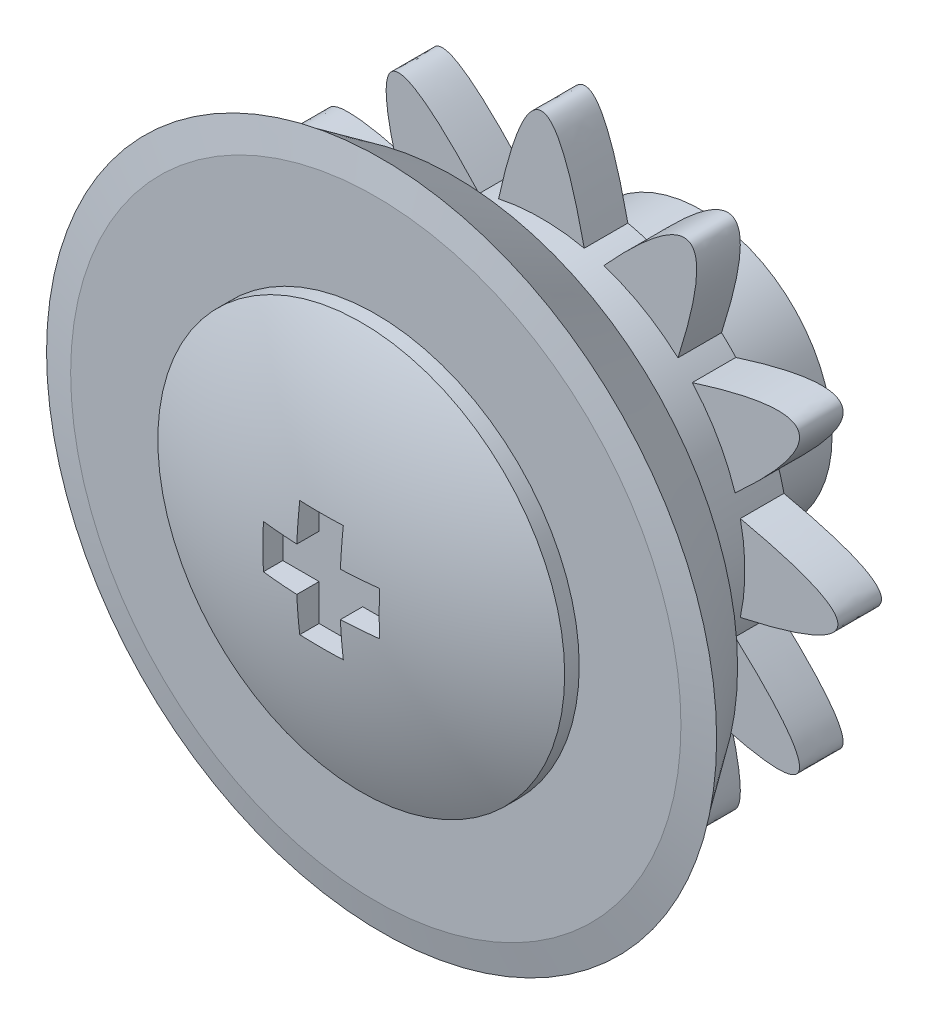
from build123d import *
from build123d.topology import SkipClean

# Parameters (mm, degrees)
SKETCH1_R             = 7
GEARPLATE_DEPTH       = 1.5
BOSS_EXTRUDE3_DEPTH   = 1.5
CIRPATTERN2_COUNT     = 12
SKETCH3_R             = 4.5
BACKPLATE_DEPTH       = 4
SKETCH4_R             = 7
PLATE_DEPTH           = 3
SKETCH6_R             = 11.5
ANGLEPLATE_DEPTH      = 2.5
ANGLEPLATE_DRAFT      = -35
SKETCH8_R             = 10.5
SMALLANGLEPLATE_DEPTH = 0.2
SMALLANGLEPLATE_DRAFT = 79
SKETCH9_R             = 7
DOMEEXTRUDE_DEPTH     = 0.5
DOME1_FACE_RADIUS     = 7
DOME1_HEIGHT          = 1.5
CUT_EXTRUDE1_DEPTH    = 3.8


with BuildPart() as part:
    # Sketch1 → GearPlate (new body)
    with BuildSketch(Plane.XY):
        Circle(SKETCH1_R)
    extrude(amount=GEARPLATE_DEPTH)

    # Sketch2 → Boss-Extrude3 (add)
    with BuildSketch(Plane.XY.offset(1.5)):
        with BuildLine():
            Line((-1.47374446, 6.843104359), (1.47374446, 6.843104359))
            add(Edge.make_bspline(
                [(-1.47374446, 6.843104359), (0, 13.556322037), (1.47374446, 6.843104359)],
                knots=[0, 0, 0, 1, 1, 1], degree=2))
        make_face()
    boss_extrude3 = extrude(amount=-BOSS_EXTRUDE3_DEPTH)

    # CirPattern2: Boss-Extrude3 ×12 about axis
    cirpattern2_axis = Axis((0, 0, 1.5), (0, 0, -1))
    for i in range(1, CIRPATTERN2_COUNT):
        add(boss_extrude3.rotate(cirpattern2_axis, i * 360 / CIRPATTERN2_COUNT))

    # Sketch3 → BackPlate (add)
    with BuildSketch(Plane(origin=(0, 0, 0), x_dir=(-1, 0, 0), z_dir=(0, 0, -1))):
        with Locations(Location((0, 0, 0), (0, 0, 180))):
            Circle(SKETCH3_R)
    extrude(amount=BACKPLATE_DEPTH)

    # Sketch4 → Plate (add)
    with BuildSketch(Plane.XY.offset(1.5)):
        with Locations(Location((0, 0, 0), (0, 0, 192.153701922))):
            Circle(SKETCH4_R)
    extrude(amount=PLATE_DEPTH)


with BuildPart() as angleplate_tool:
    # Sketch6 → AnglePlate (with draft: the straight prism first)
    with BuildSketch(Plane.XY.offset(7)):
        Circle(SKETCH6_R)
    extrude(amount=-ANGLEPLATE_DEPTH)
    # AnglePlate: the draft: its side faces are tilted about the plane it starts from
    angleplate_sides = [angleplate_tool.faces().sort_by_distance(p)[0] for p in [
        (-11.5, 0, 5.75),
    ]]
    draft(angleplate_sides, Plane.XY.offset(7), ANGLEPLATE_DRAFT)


with BuildPart() as part_1:
    add(part.part)

    # AnglePlate: add angleplate_tool
    add(angleplate_tool.part)


with BuildPart() as smallangleplate_tool:
    # Sketch8 → SmallAnglePlate (with draft: the straight prism first)
    with BuildSketch(Plane.XY.offset(7.2)):
        Circle(SKETCH8_R)
    extrude(amount=-SMALLANGLEPLATE_DEPTH)
    # SmallAnglePlate: the draft: its side faces are tilted about the plane it starts from
    smallangleplate_sides = [smallangleplate_tool.faces().sort_by_distance(p)[0] for p in [
        (-10.5, 0, 7.1),
    ]]
    draft(smallangleplate_sides, Plane.XY.offset(7.2), SMALLANGLEPLATE_DRAFT)


with BuildPart() as part_2:
    add(part_1.part)

    # SmallAnglePlate: add smallangleplate_tool
    add(smallangleplate_tool.part)

    # Sketch9 → DomeExtrude (add)
    with SkipClean():  # the faces are left unmerged after this step: merging them gives an invalid solid
        with BuildSketch(Plane.XY.offset(7.2)):
            with Locations(Location((0, 0, 0), (0, 0, 192.153701922))):
                Circle(SKETCH9_R)
        extrude(amount=DOMEEXTRUDE_DEPTH)

    # Dome1: a dome of height H over a round flat face of radius A is a cap of a sphere of radius (A * A + H * H) / (2 * H)
    dome1_r = (DOME1_FACE_RADIUS * DOME1_FACE_RADIUS + DOME1_HEIGHT * DOME1_HEIGHT) / (2 * DOME1_HEIGHT)
    dome1_base = Plane((0, 0, 7.7), z_dir=(0, 0, 1))
    with Locations(dome1_base.offset(DOME1_HEIGHT - dome1_r)):
        dome1_ball = Sphere(dome1_r, mode=Mode.PRIVATE)
    add(split(dome1_ball, bisect_by=dome1_base, keep=Keep.TOP, mode=Mode.PRIVATE))

    # Sketch11 → Cut-Extrude1 (cut)
    with SkipClean():  # the faces are left unmerged after this step: merging them gives an invalid solid
        with BuildSketch(Plane.XY.offset(12.2)):
            Polygon((-0.75, 2), (0.75, 2), (0.75, 0.75), (2, 0.75), (2, -0.75), (0.75, -0.75), (0.75, -2), (-0.75, -2), (-0.75, -0.75), (-2, -0.75), (-2, 0.75), (-0.75, 0.75), align=None)
        extrude(amount=-CUT_EXTRUDE1_DEPTH, mode=Mode.SUBTRACT)


solid = part_2.part
